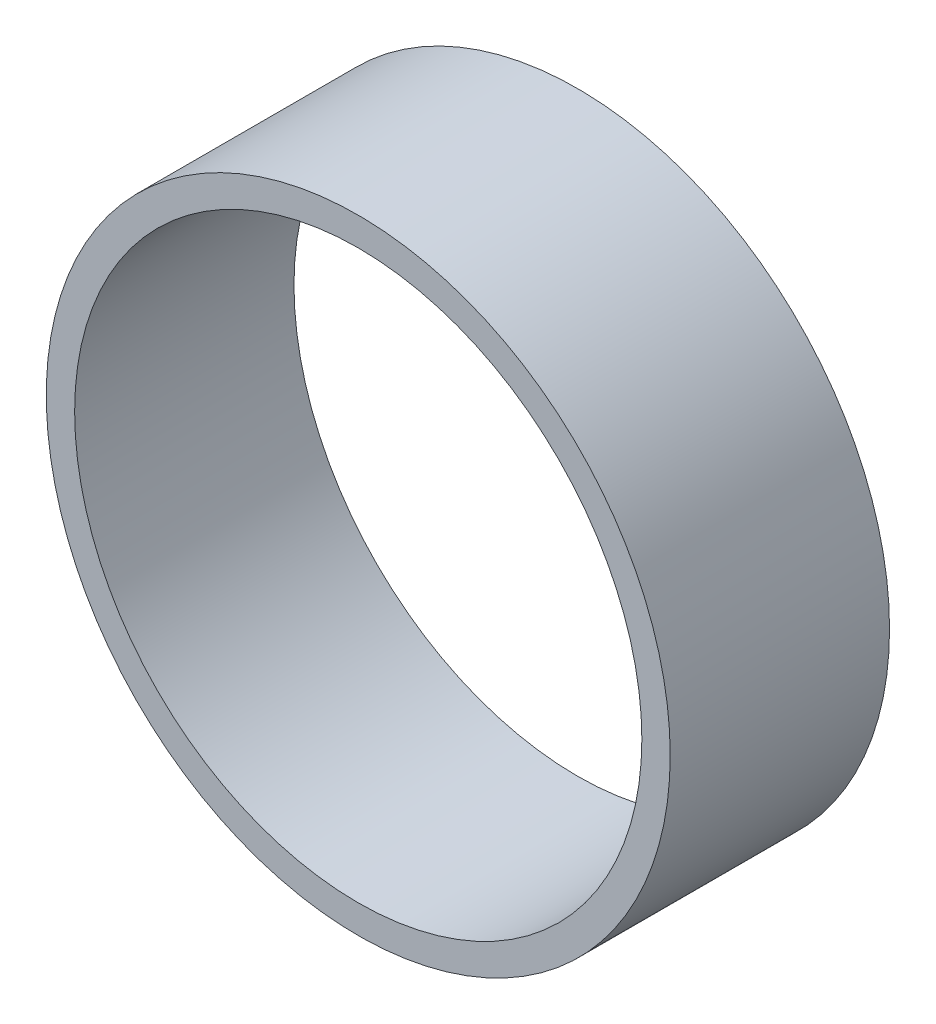
from build123d import *

# Parameters (mm, degrees)
SKETCH1_R           = 8.25
BOSS_EXTRUDE1_DEPTH = 5.8
SKETCH2_R           = 7.5
CUT_EXTRUDE1_DEPTH  = 5.8


with BuildPart() as part:
    # Sketch1 → Boss-Extrude1 (new body)
    with BuildSketch(Plane.XY):
        with Locations((-43.212664647, 1.441865661)):
            Circle(SKETCH1_R)
    extrude(amount=BOSS_EXTRUDE1_DEPTH)

    # Sketch2 → Cut-Extrude1 (cut)
    with BuildSketch(Plane.XY.offset(5.8)):
        with Locations((-43.212664647, 1.441865661)):
            Circle(SKETCH2_R)
    extrude(amount=-CUT_EXTRUDE1_DEPTH, mode=Mode.SUBTRACT)


solid = part.part
